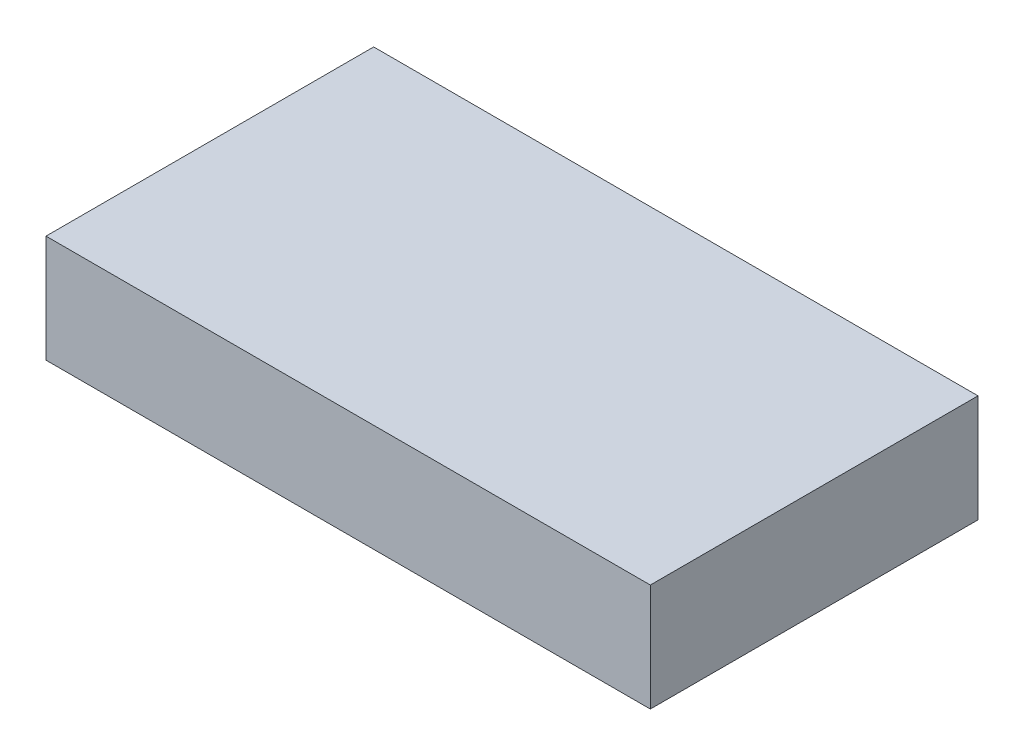
from build123d import *

# Parameters (mm, degrees)
SKETCH1_W           = 11.25
SKETCH1_H           = 6.1
BOSS_EXTRUDE1_DEPTH = 2
SKETCH2_W           = 10.615
SKETCH2_H           = 2.73
CUT_EXTRUDE1_DEPTH  = 3.81
SKETCH4_R           = 0.309051048
BOSS_EXTRUDE2_DEPTH = 3.81
FILLET1_R           = 0.254


with BuildPart() as part:
    # Sketch1 → Boss-Extrude1 (new body)
    with BuildSketch(Plane(origin=(0, 0, 0), x_dir=(1, 0, 0), z_dir=(0, 1, 0))):
        Rectangle(SKETCH1_W, SKETCH1_H)
    extrude(amount=BOSS_EXTRUDE1_DEPTH)

    # Sketch2 → Cut-Extrude1 (cut)
    with BuildSketch(Plane(origin=(0, 0, -3.05), x_dir=(-1, 0, 0), z_dir=(0, 0, -1))):
        Rectangle(SKETCH2_W, SKETCH2_H)
    extrude(amount=-CUT_EXTRUDE1_DEPTH, mode=Mode.SUBTRACT)

    # Sketch4 → Boss-Extrude2 (add)
    with BuildSketch(Plane(origin=(0, 0, 0.76), x_dir=(-1, 0, 0), z_dir=(0, 0, -1))):
        with Locations(Location((-3.53822, 0.6825, 0), (0, 0, 180))):
            Circle(SKETCH4_R)
        with Locations(Location((-1.76911, 0.6825, 0), (0, 0, 180))):
            Circle(SKETCH4_R)
        with Locations(Location((0, 0.6825, 0), (0, 0, 180))):
            Circle(SKETCH4_R)
        with Locations(Location((1.76911, 0.6825, 0), (0, 0, 180))):
            Circle(SKETCH4_R)
        with Locations(Location((3.53822, 0.6825, 0), (0, 0, 180))):
            Circle(SKETCH4_R)
    extrude(amount=BOSS_EXTRUDE2_DEPTH)

    # Fillet1
    fillet1_edges = [part.edges().sort_by_distance(p)[0] for p in [
        (3.229168952, 0.6825, -3.05),
        (1.460058952, 0.6825, -3.05),
        (-0.309051048, 0.6825, -3.05),
        (-2.078161048, 0.6825, -3.05),
        (-3.847271048, 0.6825, -3.05),
    ]]
    fillet(fillet1_edges, radius=FILLET1_R)


solid = part.part
